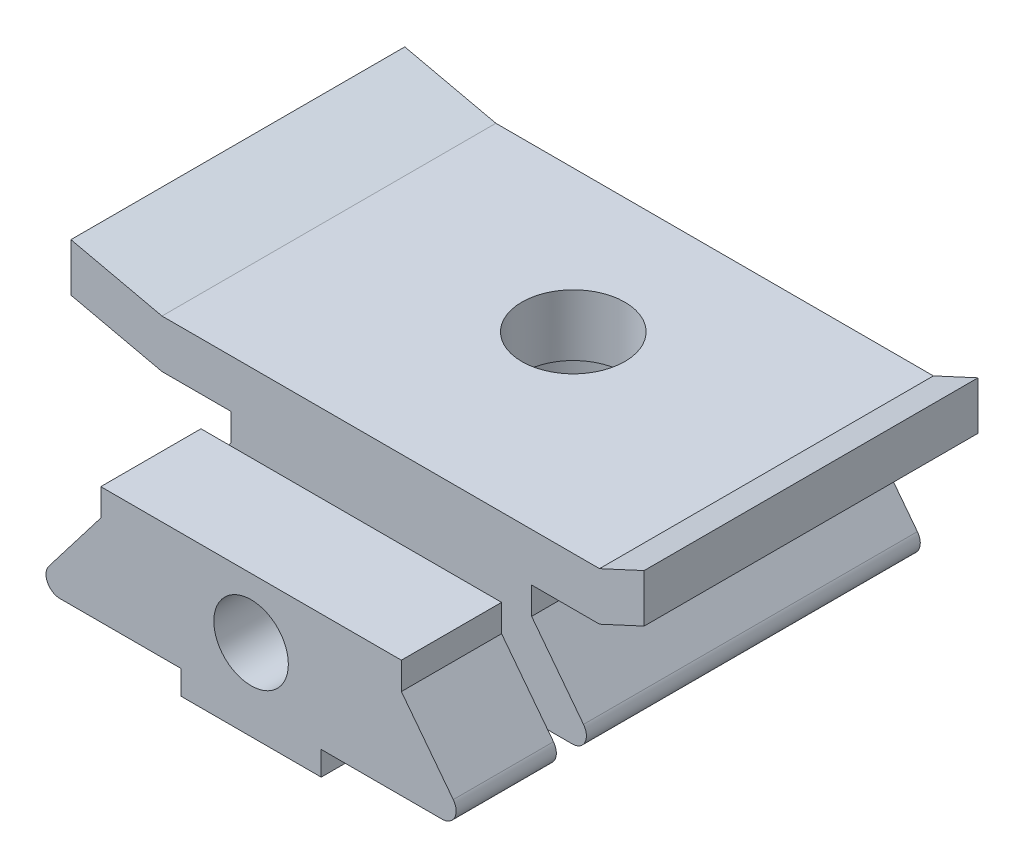
from build123d import *

# Parameters (mm, degrees)
BOSS_EXTRUDE1_DEPTH      = 21.1582
SKETCH5_W                = 8.89
SKETCH5_H                = 6.35
CUT_EXTRUDE2_DEPTH       = 40
BOSS_EXTRUDE2_DEPTH      = 21.1582
BOSS_EXTRUDE2_DEPTH_BACK = 8.255
CUT_EXTRUDE3_DEPTH       = 44.94741167
CUT_EXTRUDE3_DEPTH_BACK  = 44.94741167
SKETCH9_W                = 9.686151671
SKETCH9_H                = 23.108692275
CUT_EXTRUDE4_DEPTH       = 14.097
SKETCH10_R               = 2.3622
CUT_EXTRUDE5_DEPTH       = 14.097


with BuildPart() as part:
    # Sketch1 → Boss-Extrude1 (new body)
    with BuildSketch(Plane.XY):
        with BuildLine():
            ThreePointArc((-12.107560068, -24.539011499), (-12.904879935, -24.043206145), (-12.812851187, -23.108822589))
            Line((-12.812851187, -23.108822589), (-9.525, -18.824011499))
            Line((-9.525, -18.824011499), (-9.525, -17.10150063))
            Line((-9.525, -17.10150063), (-13.899640283, -17.10150063))
            Line((-13.899640283, -17.10150063), (-13.899640283, -14.05350063))
            Line((-13.899640283, -14.05350063), (13.828023576, -14.05350063))
            Line((13.828023576, -14.05350063), (13.828023576, -17.10150063))
            Line((13.828023576, -17.10150063), (9.525, -17.10150063))
            Line((9.525, -17.10150063), (9.525, -18.824011499))
            Line((9.525, -18.824011499), (12.812851187, -23.108822589))
            ThreePointArc((12.812851187, -23.108822589), (12.904879935, -24.043206145), (12.107560068, -24.539011499))
            Line((12.107560068, -24.539011499), (-12.107560068, -24.539011499))
        make_face()
        Polygon((16.65409094, -15.794154454), (13.828023576, -17.10150063), (13.828023576, -14.05350063), (16.65409094, -12.746154454), align=None)
        Polygon((-19.671250338, -12.746154454), (-19.671250338, -15.794154454), (-13.899640283, -17.10150063), (-13.899640283, -14.05350063), align=None)
    extrude(amount=BOSS_EXTRUDE1_DEPTH)

    # Sketch5 → Cut-Extrude2 (cut)
    with BuildSketch(Plane(origin=(0, -1.591732139, 22.762830088), x_dir=(1, 0, 0), z_dir=(0, -0.06975647374412544, 0.9975640502598242))):
        with Locations((0, -24.908314278)):
            Rectangle(SKETCH5_W, SKETCH5_H)
    extrude(amount=-CUT_EXTRUDE2_DEPTH, mode=Mode.SUBTRACT)


with BuildPart() as body_2:
    # Sketch7 → Boss-Extrude2 (new, two sides: drawn at the far end of the back side and taken through both)
    with BuildSketch(Plane(origin=(0, 0, 21.1582), x_dir=(-1, 0, 0), z_dir=(0, 0, -1)).offset(-BOSS_EXTRUDE2_DEPTH_BACK)):
        with BuildLine():
            Line((-9.525, -17.10150063), (9.525, -17.10150063))
            Line((9.525, -17.10150063), (9.525, -18.824011499))
            Line((9.525, -18.824011499), (12.812851187, -23.108822589))
            ThreePointArc((12.812851187, -23.108822589), (12.904879935, -24.043206145), (12.107560068, -24.539011499))
            Line((12.107560068, -24.539011499), (4.445, -24.539011499))
            Line((4.445, -24.539011499), (4.445, -26.063011499))
            Line((4.445, -26.063011499), (-4.445, -26.063011499))
            Line((-4.445, -26.063011499), (-4.445, -24.539011499))
            Line((-4.445, -24.539011499), (-12.107560068, -24.539011499))
            ThreePointArc((-12.107560068, -24.539011499), (-12.904879935, -24.043206145), (-12.812851187, -23.108822589))
            Line((-12.812851187, -23.108822589), (-9.525, -18.824011499))
            Line((-9.525, -18.824011499), (-9.525, -17.10150063))
        make_face()
    extrude(amount=BOSS_EXTRUDE2_DEPTH + BOSS_EXTRUDE2_DEPTH_BACK)

    # Sketch8 → Cut-Extrude3 (cut, two sides: drawn at the far end of the back side and taken through both)
    with BuildSketch(Plane(origin=(0, 0, 0), x_dir=(0, 0, -1), z_dir=(1, 0, 0)).offset(-CUT_EXTRUDE3_DEPTH_BACK)):
        Polygon((-23.0632, -15.881909333), (-23.0632, -23.265910289), (-21.1582, -23.265910289), (3.175, -21.564367188), (3.175, -15.881909333), align=None)
    extrude(amount=CUT_EXTRUDE3_DEPTH + CUT_EXTRUDE3_DEPTH_BACK, mode=Mode.SUBTRACT)

    # Sketch9 → Cut-Extrude4 (cut)
    with BuildSketch(Plane.XZ.offset(24.539011499)):
        with Locations((-9.288075836, 11.508853863)):
            Rectangle(SKETCH9_W, SKETCH9_H)
        with Locations((9.288075836, 11.508853863)):
            Rectangle(SKETCH9_W, SKETCH9_H)
    extrude(amount=-CUT_EXTRUDE4_DEPTH, mode=Mode.SUBTRACT)

    # Sketch10 → Cut-Extrude5 (cut)
    with BuildSketch(Plane.XY.offset(29.4132)):
        with Locations((0, -20.903710289)):
            Circle(SKETCH10_R)
    extrude(amount=-CUT_EXTRUDE5_DEPTH, mode=Mode.SUBTRACT)


with BuildPart() as cbore_for_1_4_socket_head_cap_screw1_tool:
    # Sketch3 → CBORE for 1/4 Socket Head Cap Screw1 (revolve)
    with BuildSketch(Plane(origin=(0, -24.539011499, 8.991954404), x_dir=(0, 0, -1), z_dir=(1, 0, 0))):
        Polygon((0, 0), (0, 14.965948974), (3.2639, 13.0048), (3.2639, 6.604), (4.8895, 6.604), (4.8895, 0), align=None)
    revolve(axis=Axis((0, -30.889011499, 8.991954404), (0, 1, 0)))


with BuildPart() as part_1:
    add(part.part)

    # CBORE for 1/4 Socket Head Cap Screw1: cut by cbore_for_1_4_socket_head_cap_screw1_tool
    add(cbore_for_1_4_socket_head_cap_screw1_tool.part, mode=Mode.SUBTRACT)


with BuildPart() as body_2_1:
    add(body_2.part)

    # CBORE for 1/4 Socket Head Cap Screw1: cut by cbore_for_1_4_socket_head_cap_screw1_tool
    add(cbore_for_1_4_socket_head_cap_screw1_tool.part, mode=Mode.SUBTRACT)


solid = Compound([part_1.part, body_2_1.part])
